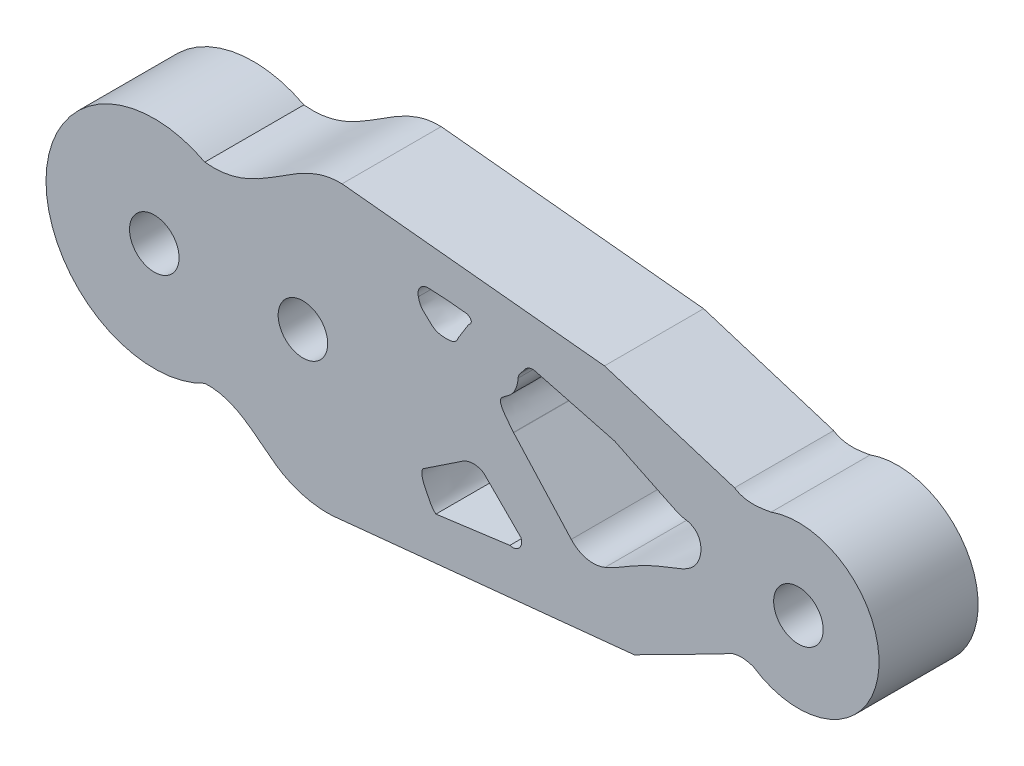
from build123d import *

# Parameters (mm, degrees)
SKETCH1_R               = 2.5
BOSS_EXTRUDE1_DEPTH     = 5
CUT_EXTRUDE1_DEPTH      = 63.053438595
CUT_EXTRUDE1_DEPTH_BACK = 63.053438595
FILLET_1MM_R            = 1
FILLET_3MM_R            = 3


with BuildPart() as part:
    # Sketch1 → Boss-Extrude1 (new, symmetric)
    with BuildSketch(Plane.XY):
        with BuildLine():
            Line((1.370602209, 14.9582984), (51.004064798, 9.949465005))
            ThreePointArc((51.004064798, 9.949465005), (60, 0), (51.004064798, -9.949465005))
            Line((51.004064798, -9.949465005), (1.370602209, -14.9582984))
            ThreePointArc((1.370602209, -14.9582984), (0.289429434, -15.018171395), (-0.793247409, -15))
            Line((-0.793247409, -15), (-15, -15))
            ThreePointArc((-15, -15), (-29.999996344, -0.010472716), (-15.020945427, 14.999985376))
            Line((-15.020945427, 14.999985376), (0, 15.020960071))
            ThreePointArc((0, 15.020960071), (0.686016928, 15.005286476), (1.370602209, 14.9582984))
        make_face()
        with Locations((-15, 0)):
            Circle(SKETCH1_R, mode=Mode.SUBTRACT)
        Circle(SKETCH1_R, mode=Mode.SUBTRACT)
        with Locations((50, 0)):
            Circle(SKETCH1_R, mode=Mode.SUBTRACT)
    extrude(amount=BOSS_EXTRUDE1_DEPTH, both=True)

    # Sketch3 → Cut-Extrude1 (cut, two sides: drawn at the far end of the back side and taken through both)
    with BuildSketch(Plane.XY.offset(-CUT_EXTRUDE1_DEPTH_BACK)):
        with BuildLine():
            add(Edge.make_bspline(
                [(-9.903552514, -9.666856323), (-7.476526803, -9.533199131), (-5.112477631, -11.33215709), (-1.419900227, -14.307798132), (1.248258646, -14.893104181), (3.011734347, -14.792681153)],
                knots=[0, 0, 0, 0, 0.454121396, 0.625343613, 1, 1, 1, 1], degree=3))
            Line((3.011734347, -14.792681153), (3.011734347, -19.334119217))
            Line((3.011734347, -19.334119217), (-33.098360308, -19.334119217))
            Line((-33.098360308, -19.334119217), (-33.098360308, 23.598998457))
            Line((-33.098360308, 23.598998457), (3.949930574, 23.598998457))
            Line((3.949930574, 23.598998457), (3.949930574, 14.69800171))
            add(Edge.make_bspline(
                [(-9.903552514, 9.666856323), (-6.652147518, 9.320096166), (-2.575157403, 12.180713674), (1.739923007, 14.763020307), (3.949930574, 14.69800171)],
                knots=[0, 0, 0, 0, 0.582391985, 1, 1, 1, 1], degree=3))
            ThreePointArc((-9.903552514, 9.666856323), (-25.928032217, 0), (-9.903552514, -9.666856323))
        make_face()
        with BuildLine():
            Line((13.422041161, -9.429006863), (20.881371876, -8.43126199))
            ThreePointArc((20.881371876, -8.43126199), (21.847495605, -8.160320639), (21.975684975, -7.165146401))
            Line((21.975684975, -7.165146401), (18.229705834, -3.41916726))
            ThreePointArc((18.229705834, -3.41916726), (17.156423485, -3.135604097), (16.097610829, -3.469158928))
            Line((16.097610829, -3.469158928), (12.06197208, -6.153326887))
            add(Edge.make_bspline(
                [(12.06197208, -6.153326887), (11.880071817, -6.848989266), (12.495445712, -7.927745141), (12.96639196, -9.063942624), (13.422041161, -9.429006863)],
                knots=[0, 0, 0, 0, 0.534201907, 1, 1, 1, 1], degree=3))
        make_face()
        with BuildLine():
            add(Edge.make_bspline(
                [(15.674640659, 7.098513093), (15.49672397, 6.468182077), (14.496468627, 6.357357892), (13.234107622, 6.56446163), (12.574974034, 7.320216924), (11.846331825, 7.907204564), (11.592995194, 8.901133679), (11.380851032, 9.582622864), (11.437882459, 10.014131639)],
                knots=[0, 0, 0, 0, 0.243008467, 0.400784189, 0.557347039, 0.677228271, 0.810823164, 1, 1, 1, 1], degree=3))
            Line((11.437882459, 10.014131639), (14.687582297, 9.83190548))
            Line((14.687582297, 9.83190548), (16.206133624, 9.666856323))
            add(Edge.make_bspline(
                [(16.206133624, 9.666856323), (16.619100034, 9.733976993), (17.408112438, 9.27156347), (16.707255561, 8.768919552)],
                knots=[0, 0, 0, 0, 1, 1, 1, 1], degree=3))
            Line((16.707255561, 8.768919552), (15.674640659, 7.098513093))
        make_face()
        with BuildLine():
            add(Edge.make_bspline(
                [(21.729031688, 6.823806783), (21.939045039, 7.341434845), (22.486267271, 7.383655673), (22.515916332, 8.313571308)],
                knots=[0.760302032, 0.760302032, 0.760302032, 0.760302032, 1, 1, 1, 1], degree=3))
            Line((22.515916332, 8.313571308), (31.469621951, 5.963223583))
            Line((31.469621951, 5.963223583), (38.184901166, 2.717505296))
            add(Edge.make_bspline(
                [(38.184901166, 2.717505296), (40.464447122, 2.725575269), (40.567260603, -0.931942624), (37.022828715, -2.289970909), (33.197915496, -3.793907945), (30.519351146, -5.92883722), (28.289027453, -6.153326887)],
                knots=[0, 0, 0, 0, 0.267174641, 0.422388406, 0.624449878, 1, 1, 1, 1], degree=3))
            Line((28.289027453, -6.153326887), (21.255156217, 1.611176601))
            add(Edge.make_bspline(
                [(21.255156217, 1.611176601), (18.09754055, 5.332684448), (21.561206138, 3.149309214), (21.729031688, 6.823806783)],
                knots=[0, 0, 0, 0, 1, 1, 1, 1], degree=3))
        make_face()
        with BuildLine():
            ThreePointArc((45.492416587, -6.772728508), (58.076251026, -0.980983712), (47.2448713, 7.654895527))
            add(Edge.make_bspline(
                [(43.548434402, 7.933716322), (44.667988914, 7.224515292), (46.028250353, 7.426448696), (47.2448713, 7.654895527)],
                knots=[0, 0, 0, 0, 1, 1, 1, 1], degree=3))
            Line((43.548434402, 7.933716322), (30.429215287, 12.025806005))
            Line((30.429215287, 12.025806005), (30.429215287, 19.726367019))
            Line((30.429215287, 19.726367019), (61.718394051, 19.726367019))
            Line((61.718394051, 19.726367019), (61.718394051, -17.852413161))
            Line((61.718394051, -17.852413161), (30.429215287, -17.852413161))
            Line((30.429215287, -17.852413161), (30.429215287, -13.246391922))
            Line((30.429215287, -13.246391922), (42.404870508, -7.165146401))
            add(Edge.make_bspline(
                [(42.404870508, -7.165146401), (43.791319621, -6.125801539), (45.492416587, -6.772728508)],
                knots=[0, 0, 0, 1, 1, 1], degree=2))
        make_face()
    extrude(amount=CUT_EXTRUDE1_DEPTH + CUT_EXTRUDE1_DEPTH_BACK, mode=Mode.SUBTRACT)

    # Fillet_1mm
    fillet_1mm_edges = [part.edges().sort_by_distance(p)[0] for p in [
        (14.687582297, 9.83190548, 0),
        (11.437882459, 10.014131639, -2.5),
        (21.255156217, 1.611176601, -2.5),
        (31.469621951, 5.963223583, 0),
        (22.515916332, 8.313571308, -2.5),
        (21.729031688, 6.823806783, -2.5),
        (15.674640659, 7.098513093, -2.5),
        (16.707255561, 8.768919552, -2.5),
        (16.206133624, 9.666856323, -2.5),
    ]]
    fillet(fillet_1mm_edges, radius=FILLET_1MM_R)

    # Fillet_3mm
    fillet_3mm_edges = [part.edges().sort_by_distance(p)[0] for p in [
        (28.289027453, -6.153326887, 2.5),
        (38.184901166, 2.717505296, -2.5),
    ]]
    fillet(fillet_3mm_edges, radius=FILLET_3MM_R)


solid = part.part
